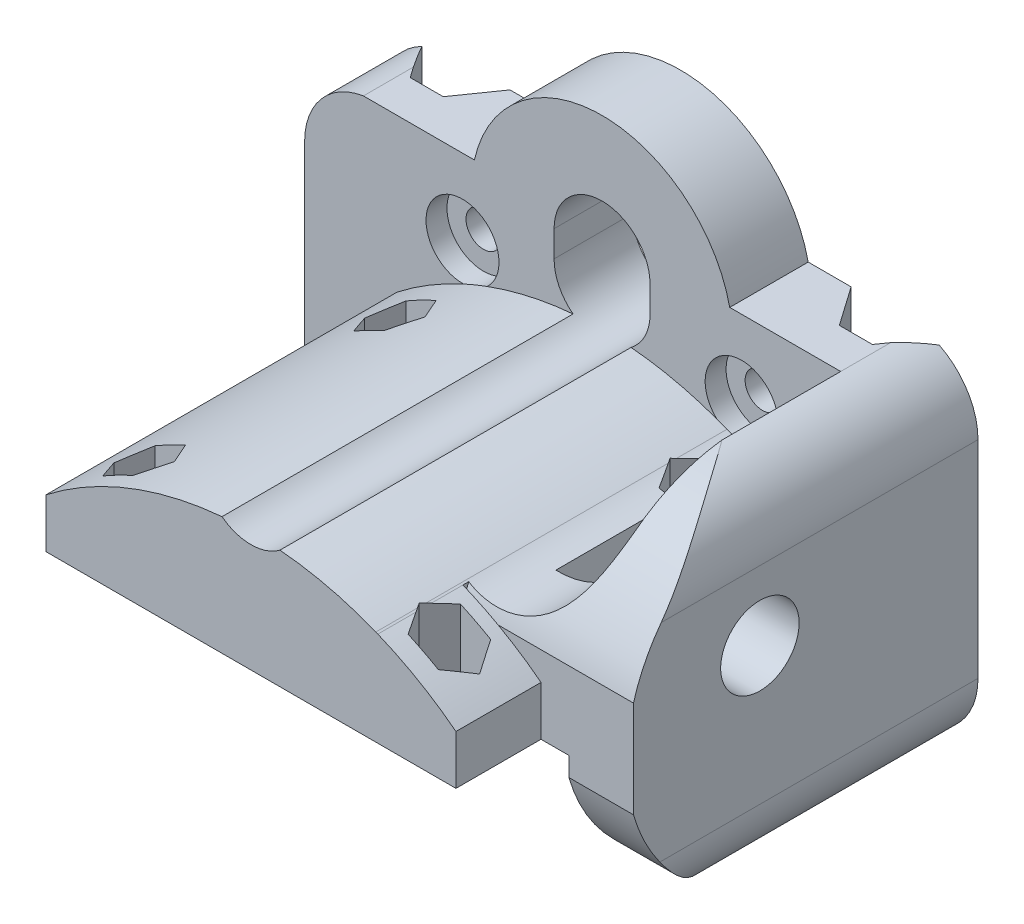
from build123d import *

# Parameters (mm, degrees)
SKETCH1_R                = 2.000043321
SKETCH1_R_2              = 2.000014119
BOSS_EXTRUDE1_DEPTH      = 4.5
CUT_EXTRUDE2_DEPTH       = 46.343813751
BOSS_EXTRUDE2_START      = 40.25
SKETCH6_W                = 23.5
SKETCH6_H                = 5.65
BOSS_EXTRUDE2_DEPTH      = 40.25
SKETCH3_R                = 4.181725
CUT_EXTRUDE3_DEPTH       = 2.4
BOSS_EXTRUDE3_START      = 30.5
BOSS_EXTRUDE3_DEPTH      = 30.5
SKETCH21_W               = 12.385700762
SKETCH21_H               = 18.597289034
CUT_EXTRUDE16_DEPTH      = 60.959352444
CUT_EXTRUDE20_DEPTH      = 19.55588
CUT_EXTRUDE21_DEPTH      = 64.068406998
CUT_EXTRUDE21_DEPTH_BACK = 64.068406998
CUT_EXTRUDE6_DEPTH       = 64.068406998
CUT_EXTRUDE6_DEPTH_BACK  = 4.1004
SKETCH9_7_R              = 1.8
CUT_EXTRUDE5_DEPTH       = 64.068406927
CUT_EXTRUDE5_DEPTH_BACK  = 64.068406927
SKETCH9_R                = 1.8
SKETCH32_R               = 4.496907104
CUT_EXTRUDE28_DEPTH      = 7.399999239


with BuildPart() as part:
    # Sketch1 → Boss-Extrude1 (new, symmetric)
    with BuildSketch(Plane.XY):
        with BuildLine():
            ThreePointArc((27.3591, -22.750023286), (32.18573506, -20.04264062), (34.100000001, -14.850154064))
            Line((34.100000001, -14.850154064), (34.100000001, 8.850156137))
            ThreePointArc((34.100000001, 8.850156137), (32.18573506, 14.042642693), (27.3591, 16.750025358))
            Line((27.3591, 16.750025358), (14.6356, 16.750025358))
            ThreePointArc((14.6356, 16.750025358), (0, 28.500025358), (-14.6356, 16.750025358))
            Line((-14.6356, 16.750025358), (-27.3591, 16.750025358))
            ThreePointArc((-27.3591, 16.750025358), (-32.18573506, 14.042642693), (-34.100000001, 8.850156137))
            Line((-34.100000001, 8.850156137), (-34.100000001, -14.850154064))
            ThreePointArc((-34.100000001, -14.850154064), (-32.18573506, -20.04264062), (-27.3591, -22.750023286))
            Line((-27.3591, -22.750023286), (-11.500037792, -22.750023286))
            ThreePointArc((-11.500037792, -22.750023286), (-8.671570628, -21.578433826), (-7.499981167, -18.749966661))
            Line((-7.499981167, -18.749966661), (-7.499981167, -16.089239323))
            ThreePointArc((-7.499981167, -16.089239323), (-7.500113179, -16.044739987), (-7.499981167, -16.000240651))
            ThreePointArc((-7.499981167, -16.000240651), (0, -8.544626807), (7.499981167, -16.000240651))
            ThreePointArc((7.499981167, -16.000240651), (7.500113179, -16.044739987), (7.499981167, -16.089239323))
            Line((7.499981167, -16.089239323), (7.499981167, -18.749966661))
            ThreePointArc((7.499981167, -18.749966661), (8.671570628, -21.578433826), (11.500037792, -22.750023286))
            Line((11.500037792, -22.750023286), (27.3591, -22.750023286))
        make_face()
        with Locations((-16.000068831, -16.5)):
            Circle(SKETCH1_R, mode=Mode.SUBTRACT)
        with Locations((16.000068831, -16.5)):
            Circle(SKETCH1_R, mode=Mode.SUBTRACT)
        with Locations((-16.000068831, 7.999981023)):
            Circle(SKETCH1_R_2, mode=Mode.SUBTRACT)
        with Locations((16.000068831, 7.999981023)):
            Circle(SKETCH1_R_2, mode=Mode.SUBTRACT)
    extrude(amount=BOSS_EXTRUDE1_DEPTH, both=True)

    # Sketch4 → Cut-Extrude2 (cut, through all)
    with BuildSketch(Plane.XY.offset(4.5)):
        with BuildLine():
            Line((5.5, 11.5), (5.5, 14.5))
            ThreePointArc((5.5, 14.5), (0, 20), (-5.5, 14.5))
            Line((-5.5, 14.5), (-5.5, 11.5))
            ThreePointArc((-5.5, 11.5), (0, 6), (5.5, 11.5))
        make_face()
    extrude(amount=-CUT_EXTRUDE2_DEPTH, mode=Mode.SUBTRACT)

    # Sketch6 → Boss-Extrude2 (add)
    with BuildSketch(Plane.XY.offset(4.5).offset(BOSS_EXTRUDE2_START)):
        with Locations((11.75, -3.625)):
            Rectangle(SKETCH6_W, SKETCH6_H)
        with Locations((-11.75, -3.625)):
            Rectangle(SKETCH6_W, SKETCH6_H)
        with BuildLine():
            Line((0, -0.8), (23.5, -0.8))
            ThreePointArc((23.5, -0.8), (13.984131025, 4.616883926), (3.324005419, 7.118106805))
            ThreePointArc((3.324005419, 7.118106805), (0, 6), (-3.324005419, 7.118106805))
            ThreePointArc((-3.324005419, 7.118106805), (-13.984131025, 4.616883926), (-23.5, -0.8))
            Line((-23.5, -0.8), (0, -0.8))
        make_face()
    extrude(amount=-BOSS_EXTRUDE2_DEPTH)

    # Sketch3 → Cut-Extrude3 (cut)
    with BuildSketch(Plane.XY.offset(4.5)):
        with Locations((-16.000068831, 7.999981023)):
            Circle(SKETCH3_R)
        with Locations((16.000068831, 7.999981023)):
            Circle(SKETCH3_R)
        with Locations((16.000068831, -16.500018977)):
            Circle(SKETCH3_R)
        with Locations((-16.000068831, -16.500018977)):
            Circle(SKETCH3_R)
    extrude(amount=-CUT_EXTRUDE3_DEPTH, mode=Mode.SUBTRACT)

    # Sketch15 → Boss-Extrude3 (add)
    with BuildSketch(Plane.XY.offset(4.5).offset(BOSS_EXTRUDE3_START)):
        with BuildLine():
            Line((14.314300001, 16.750025358), (14.314300001, -22.750023286))
            Line((14.314300001, -22.750023286), (27.3591, -22.750023286))
            ThreePointArc((27.3591, -22.750023286), (32.18573506, -20.04264062), (34.100000001, -14.850154064))
            Line((34.100000001, -14.850154064), (34.100000001, 8.850156137))
            ThreePointArc((34.100000001, 8.850156137), (32.18573506, 14.042642693), (27.3591, 16.750025358))
            Line((27.3591, 16.750025358), (14.314300001, 16.750025358))
        make_face()
    extrude(amount=-BOSS_EXTRUDE3_DEPTH)

    # Sketch21 → Cut-Extrude16 (cut, through all)
    with BuildSketch(Plane.XY.offset(4.5)):
        with Locations((20.507150382, -15.748644517)):
            Rectangle(SKETCH21_W, SKETCH21_H)
        with BuildLine():
            ThreePointArc((27.3591, 12.579600334), (22.93090056, 5.157449584), (14.314300001, 4.485536757))
            Line((14.314300001, 4.485536757), (14.314300001, 16.750025358))
            Line((14.314300001, 16.750025358), (27.3591, 16.750025358))
            Line((27.3591, 16.750025358), (27.3591, 12.579600334))
        make_face()
    extrude(amount=CUT_EXTRUDE16_DEPTH, mode=Mode.SUBTRACT)

    # Sketch22 → Cut-Extrude20 (cut)
    with BuildSketch(Plane(origin=(34.100000001, 0, 0), x_dir=(0, 0, -1), z_dir=(1, 0, 0))):
        with BuildLine():
            Line((-35, 18.44611001), (-35, 2.44611001))
            ThreePointArc((-35, 2.44611001), (-28.722119173, 12.152830277), (-18.115600586, 16.75))
            Line((-18.115600586, 16.75), (-18.115600586, 18.44611001))
            Line((-18.115600586, 18.44611001), (-35, 18.44611001))
        make_face()
        with BuildLine():
            ThreePointArc((-19.450399399, -22.75), (-29.235735953, -17.914679764), (-35, -8.646109581))
            Line((-35, -8.646109581), (-35, -24.646109581))
            Line((-35, -24.646109581), (-19.450399399, -24.646109581))
            Line((-19.450399399, -24.646109581), (-19.450399399, -22.75))
        make_face()
    extrude(amount=-CUT_EXTRUDE20_DEPTH, mode=Mode.SUBTRACT)

    # Sketch24 → Cut-Extrude21 (cut, two sides: drawn at the far end of the back side and taken through both)
    with BuildSketch(Plane(origin=(0, 0, 0), x_dir=(1, 0, 0), z_dir=(0, 1, 0)).offset(-CUT_EXTRUDE21_DEPTH_BACK)):
        Polygon((17.75, -16.135499954), (19.635499954, -14.25), (26.700000763, -14.25), (26.700000763, -27.549999237), (17.75, -27.549999237), align=None)
    extrude(amount=CUT_EXTRUDE21_DEPTH + CUT_EXTRUDE21_DEPTH_BACK, mode=Mode.SUBTRACT)

    # Sketch9<7> → Cut-Extrude6 (cut, two sides: drawn at the far end of the back side and taken through both)
    # profile 1 of 4: a face of its own
    with BuildSketch(Plane(origin=(0, 0, 0), x_dir=(1, 0, 0), z_dir=(0, 1, 0)).offset(-CUT_EXTRUDE6_DEPTH_BACK)):
        Polygon((-14.035898385, -39.5), (-15.767949192, -36.5), (-19.232050808, -36.5), (-20.964101615, -39.5), (-19.232050808, -42.5), (-15.767949192, -42.5), align=None)
        with Locations(Location((-17.5, -39.5, 0), (0, 0, 90))):
            Circle(SKETCH9_7_R, mode=Mode.SUBTRACT)
    # profile 2 of 4: a face of its own
    with BuildSketch(Plane(origin=(0, 0, 0), x_dir=(1, 0, 0), z_dir=(0, 1, 0)).offset(-CUT_EXTRUDE6_DEPTH_BACK)):
        Polygon((15.767949192, -36.5), (19.232050808, -36.5), (20.964101615, -39.5), (19.232050808, -42.5), (15.767949192, -42.5), (14.035898385, -39.5), align=None)
        with Locations(Location((17.5, -39.5, 0), (0, 0, 90))):
            Circle(SKETCH9_7_R, mode=Mode.SUBTRACT)
    # profile 3 of 4: a face of its own
    with BuildSketch(Plane(origin=(0, 0, 0), x_dir=(1, 0, 0), z_dir=(0, 1, 0)).offset(-CUT_EXTRUDE6_DEPTH_BACK)):
        Polygon((14.035898385, -10.744445), (15.767949192, -13.744445), (19.232050808, -13.744445), (20.964101615, -10.744445), (19.232050808, -7.744445), (15.767949192, -7.744445), align=None)
        with Locations(Location((17.5, -10.744445, 0), (0, 0, 90))):
            Circle(SKETCH9_7_R, mode=Mode.SUBTRACT)
    # profile 4 of 4: a face of its own
    with BuildSketch(Plane(origin=(0, 0, 0), x_dir=(1, 0, 0), z_dir=(0, 1, 0)).offset(-CUT_EXTRUDE6_DEPTH_BACK)):
        Polygon((-15.767949192, -13.744445), (-19.232050808, -13.744445), (-20.964101615, -10.744445), (-19.232050808, -7.744445), (-15.767949192, -7.744445), (-14.035898385, -10.744445), align=None)
        with Locations(Location((-17.5, -10.744445, 0), (0, 0, 90))):
            Circle(SKETCH9_7_R, mode=Mode.SUBTRACT)
    extrude(amount=CUT_EXTRUDE6_DEPTH + CUT_EXTRUDE6_DEPTH_BACK, mode=Mode.SUBTRACT)

    # Sketch9 → Cut-Extrude5 (cut, two sides: drawn at the far end of the back side and taken through both)
    with BuildSketch(Plane(origin=(0, 0, 0), x_dir=(1, 0, 0), z_dir=(0, 1, 0)).offset(-CUT_EXTRUDE5_DEPTH_BACK)):
        with Locations(Location((-17.5, -39.5, 0), (0, 0, 90))):
            Circle(SKETCH9_R)
        with Locations(Location((17.5, -39.5, 0), (0, 0, 90))):
            Circle(SKETCH9_R)
        with Locations(Location((-17.5, -10.744445, 0), (0, 0, 90))):
            Circle(SKETCH9_R)
        Polygon((-22.70606608, 0), (-19.555132158, 4.5), (-29.647000001, 4.5), (-26.49606608, 0), align=None)
        Polygon((19.555132158, 4.5), (29.647000001, 4.5), (26.49606608, 0), (22.70606608, 0), align=None)
        with Locations(Location((17.5, -10.744445, 0), (0, 0, 90))):
            Circle(SKETCH9_R)
    extrude(amount=CUT_EXTRUDE5_DEPTH + CUT_EXTRUDE5_DEPTH_BACK, mode=Mode.SUBTRACT)

    # Sketch32 → Cut-Extrude28 (cut)
    with BuildSketch(Plane(origin=(34.100000001, 0, 0), x_dir=(0, 0, -1), z_dir=(1, 0, 0))):
        with Locations((-20.505386522, 0.902118416)):
            Circle(SKETCH32_R)
    extrude(amount=-CUT_EXTRUDE28_DEPTH, mode=Mode.SUBTRACT)


solid = part.part
